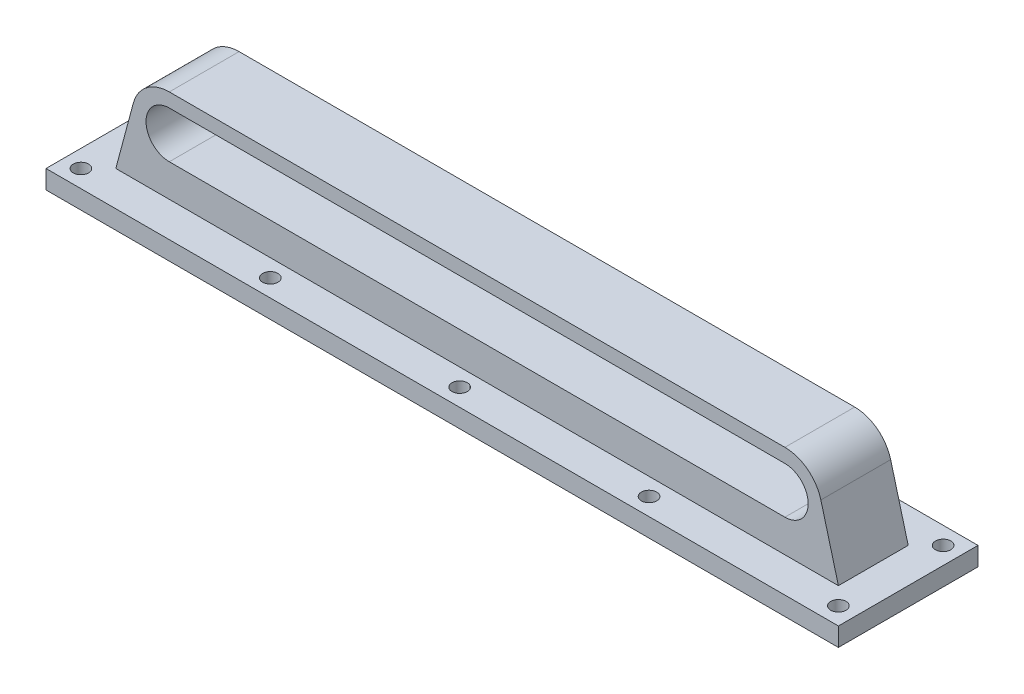
from build123d import *

# Parameters (mm, degrees)
BOSS_EXTRUDE1_DEPTH  = 15
SKETCH3_W            = 340.59039901
SKETCH3_H            = 15
BOSS_EXTRUDE2_DEPTH  = 8
M6_CLEARANCE_HOLE1_D = 6.6


with BuildPart() as part:
    # Sketch1 → Boss-Extrude1 (new, symmetric)
    with BuildSketch(Plane.XY):
        with BuildLine():
            Line((-132.3, 16), (132.3, 16))
            ThreePointArc((132.3, 16), (142.040182864, 12.693653445), (147.754813221, 4.141104722))
            Line((147.754813221, 4.141104722), (155.295199505, -24))
            Line((155.295199505, -24), (170.295199505, -24))
            Line((170.295199505, -24), (170.295199505, -32))
            Line((170.295199505, -32), (-170.295199505, -32))
            Line((-170.295199505, -32), (-170.295199505, -24))
            Line((-170.295199505, -24), (-155.295199505, -24))
            Line((-155.295199505, -24), (-147.754813221, 4.141104722))
            ThreePointArc((-147.754813221, 4.141104722), (-142.040182864, 12.693653445), (-132.3, 16))
        make_face()
        with BuildLine():
            Line((-132.3, 10), (132.3, 10))
            ThreePointArc((132.3, 10), (142.3, 0), (132.3, -10))
            Line((132.3, -10), (-132.3, -10))
            ThreePointArc((-132.3, -10), (-142.3, 0), (-132.3, 10))
        make_face(mode=Mode.SUBTRACT)
    extrude(amount=BOSS_EXTRUDE1_DEPTH, both=True)

    # Sketch3 → Boss-Extrude2 (add)
    with BuildSketch(Plane.XZ.offset(32)):
        with Locations((0, 22.5)):
            Rectangle(SKETCH3_W, SKETCH3_H)
    boss_extrude2 = extrude(amount=-BOSS_EXTRUDE2_DEPTH)

    # Mirror1: Boss-Extrude2 across plane
    add(boss_extrude2.mirror(Plane.XY))

    # M6 Clearance Hole1 (through all)
    with Locations(Plane(origin=(-162.795199505, -24, -22.5), x_dir=(1, 0, 0), z_dir=(0, 1, 0))):
        with Locations((0, 0), (0, -45), (81.397599753, -45), (81.397599753, 0), (162.795199505, -45), (162.795199505, 0), (244.192799257, -45), (244.192799257, 0), (325.59039901, 0), (325.59039901, -45)):
            Hole(M6_CLEARANCE_HOLE1_D / 2)


solid = part.part
